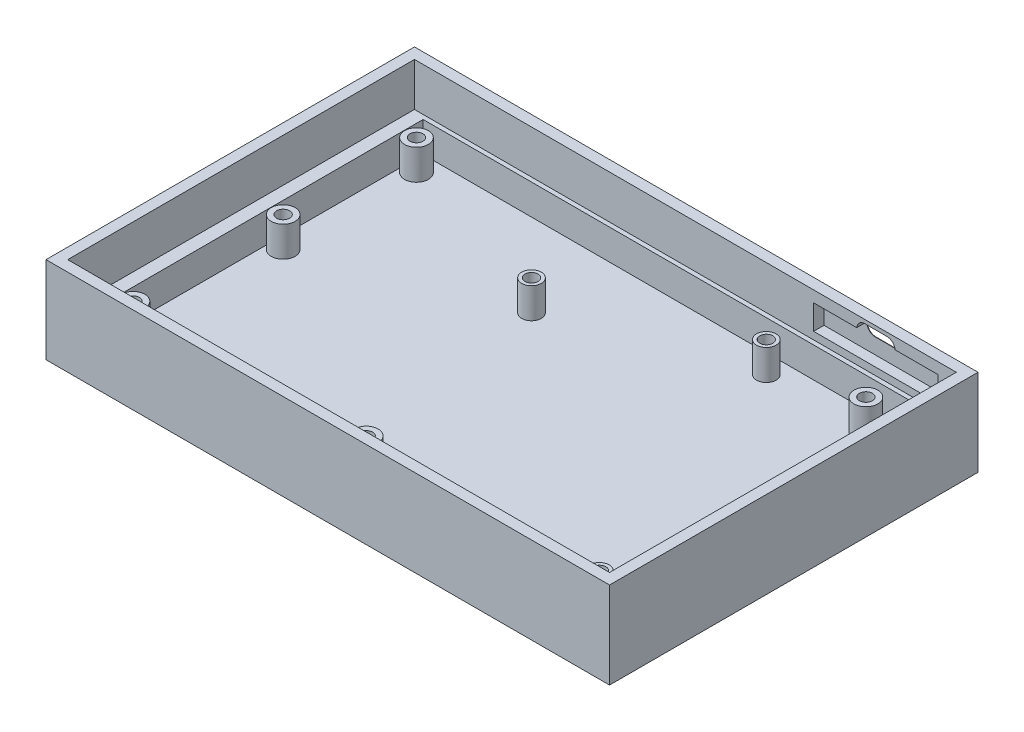
from build123d import *

# Parameters (mm, degrees)
SKETCH1_W           = 125
SKETCH1_H           = 80
BOSS_EXTRUDE1_DEPTH = 3
SKETCH1_3_W         = 130
SKETCH1_3_H         = 85
SKETCH1_3_W_2       = 125
SKETCH1_3_H_2       = 80
BOSS_EXTRUDE2_DEPTH = 20
SKETCH2_W           = 125
SKETCH2_H           = 80
SKETCH2_W_2         = 120
SKETCH2_H_2         = 76
BOSS_EXTRUDE3_DEPTH = 10
SKETCH3_W           = 28.6783421
SKETCH3_H           = 5.698707123
CUT_EXTRUDE1_DEPTH  = 2.4
CUT_EXTRUDE2_DEPTH  = 3
SKETCH5_R           = 2.75
SKETCH5_R_2         = 1.5
SKETCH5_R_3         = 2.259305414
BOSS_EXTRUDE4_DEPTH = 7


with BuildPart() as part:
    # Sketch1 → Boss-Extrude1 (new body)
    with BuildSketch(Plane(origin=(0, 0, 0), x_dir=(1, 0, 0), z_dir=(0, 1, 0))):
        Rectangle(SKETCH1_W, SKETCH1_H)
    extrude(amount=BOSS_EXTRUDE1_DEPTH)

    # Sketch1<3> → Boss-Extrude2 (add)
    with BuildSketch(Plane(origin=(0, 0, 0), x_dir=(1, 0, 0), z_dir=(0, 1, 0))):
        Rectangle(SKETCH1_3_W, SKETCH1_3_H)
        Rectangle(SKETCH1_3_W_2, SKETCH1_3_H_2, mode=Mode.SUBTRACT)
    extrude(amount=BOSS_EXTRUDE2_DEPTH)

    # Sketch2 → Boss-Extrude3 (add)
    with BuildSketch(Plane(origin=(0, 0, 0), x_dir=(1, 0, 0), z_dir=(0, 1, 0))):
        Rectangle(SKETCH2_W, SKETCH2_H)
        with Locations((0.5, 1)):
            Rectangle(SKETCH2_W_2, SKETCH2_H_2, mode=Mode.SUBTRACT)
    extrude(amount=BOSS_EXTRUDE3_DEPTH)

    # Sketch3 → Cut-Extrude1 (cut)
    with BuildSketch(Plane(origin=(0, 0, -40), x_dir=(-1, 0, 0), z_dir=(0, 0, -1))):
        with Locations((-43.918315426, 14.566401795)):
            Rectangle(SKETCH3_W, SKETCH3_H)
    extrude(amount=CUT_EXTRUDE1_DEPTH, mode=Mode.SUBTRACT)

    # Sketch4 → Cut-Extrude2 (cut)
    with BuildSketch(Plane(origin=(0, 0, -42.5), x_dir=(-1, 0, 0), z_dir=(0, 0, -1))):
        with BuildLine():
            Line((-46.479379668, 19.149715293), (-41.427177158, 19.149715293))
            ThreePointArc((-41.427177158, 19.149715293), (-39.500738632, 17.223276767), (-41.427177158, 15.296838241))
            Line((-41.427177158, 15.296838241), (-46.479379668, 15.296838241))
            ThreePointArc((-46.479379668, 15.296838241), (-48.405818194, 17.223276767), (-46.479379668, 19.149715293))
        make_face()
    extrude(amount=-CUT_EXTRUDE2_DEPTH, mode=Mode.SUBTRACT)

    # Sketch5 → Boss-Extrude4 (add)
    # profile 1 of 8: a face of its own
    with BuildSketch(Plane(origin=(0, 3, 0), x_dir=(1, 0, 0), z_dir=(0, 1, 0))):
        with Locations((-56.666408857, -30.772899219)):
            Circle(SKETCH5_R)
        with Locations((-56.666408857, -30.772899219)):
            Circle(SKETCH5_R_2, mode=Mode.SUBTRACT)
    # profile 2 of 8: a face of its own
    with BuildSketch(Plane(origin=(0, 3, 0), x_dir=(1, 0, 0), z_dir=(0, 1, 0))):
        with Locations((-56.666408857, 34.623451832)):
            Circle(SKETCH5_R)
        with Locations((-56.666408857, 34.623451832)):
            Circle(SKETCH5_R_2, mode=Mode.SUBTRACT)
    # profile 3 of 8: a face of its own
    with BuildSketch(Plane(origin=(0, 3, 0), x_dir=(1, 0, 0), z_dir=(0, 1, 0))):
        with Locations((-56.666408857, 3.874879483)):
            Circle(SKETCH5_R)
        with Locations((-56.666408857, 3.874879483)):
            Circle(SKETCH5_R_2, mode=Mode.SUBTRACT)
    # profile 4 of 8: a face of its own
    with BuildSketch(Plane(origin=(0, 3, 0), x_dir=(1, 0, 0), z_dir=(0, 1, 0))):
        with Locations((-15.376408857, 19.879433801)):
            Circle(SKETCH5_R_3)
        with Locations((-15.376408857, 19.879433801)):
            Circle(SKETCH5_R_2, mode=Mode.SUBTRACT)
    # profile 5 of 8: a face of its own
    with BuildSketch(Plane(origin=(0, 3, 0), x_dir=(1, 0, 0), z_dir=(0, 1, 0))):
        with Locations((24.041591143, 34.623451832)):
            Circle(SKETCH5_R_3)
        with Locations((24.041591143, 34.623451832)):
            Circle(SKETCH5_R_2, mode=Mode.SUBTRACT)
    # profile 6 of 8: a face of its own
    with BuildSketch(Plane(origin=(0, 3, 0), x_dir=(1, 0, 0), z_dir=(0, 1, 0))):
        with Locations((50.940615446, -30.772899219)):
            Circle(SKETCH5_R_3)
        with Locations((50.940615446, -30.772899219)):
            Circle(SKETCH5_R_2, mode=Mode.SUBTRACT)
    # profile 7 of 8: a face of its own
    with BuildSketch(Plane(origin=(0, 3, 0), x_dir=(1, 0, 0), z_dir=(0, 1, 0))):
        with Locations((-2.862896706, -30.772899219)):
            Circle(SKETCH5_R)
        with Locations((-2.862896706, -30.772899219)):
            Circle(SKETCH5_R_2, mode=Mode.SUBTRACT)
    # profile 8 of 8: a face of its own
    with BuildSketch(Plane(origin=(0, 3, 0), x_dir=(1, 0, 0), z_dir=(0, 1, 0))):
        with Locations((47.016763874, 34.623451832)):
            Circle(SKETCH5_R)
        with Locations((47.016763874, 34.623451832)):
            Circle(SKETCH5_R_2, mode=Mode.SUBTRACT)
    extrude(amount=BOSS_EXTRUDE4_DEPTH)


solid = part.part
